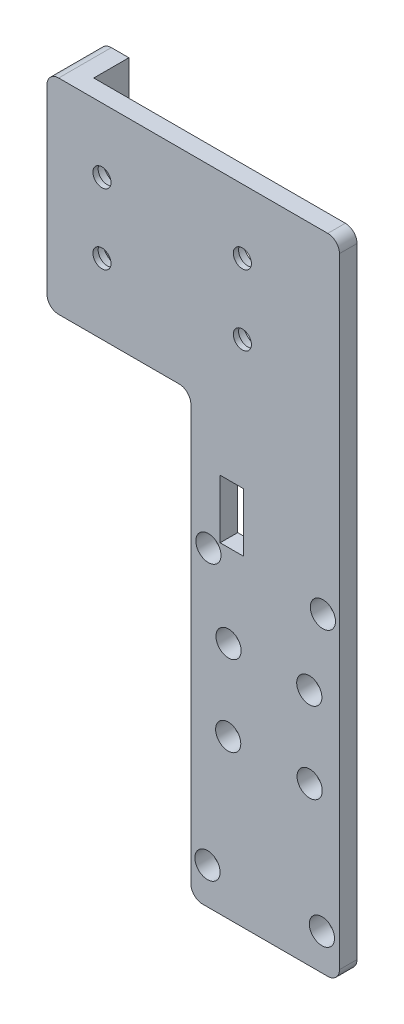
from build123d import *

# Parameters (mm, degrees)
BOSS_EXTRU_1_DEPTH                                 = 3
D_GAGEMENT_61_D                                    = 4.3053
CHAMBRAGE_POUR_VIS_T_TE_RONDE_BOMB_E_M_D           = 3.1
CHAMBRAGE_POUR_VIS_T_TE_RONDE_BOMB_E_M_CBORE_D     = 6
CHAMBRAGE_POUR_VIS_T_TE_RONDE_BOMB_E_M_CBORE_DEPTH = 2.1
ESQUISSE7_W                                        = 5
ESQUISSE7_H                                        = 20
BOSS_EXTRU_2_DEPTH                                 = 6
ENL_V_MAT_EXTRU_1_REACH                            = 117.582
ESQUISSE8_W                                        = 2
ESQUISSE8_H                                        = 6
ENL_V_MAT_EXTRU_2_REACH                            = 81.846
ESQUISSE9_W                                        = 6
ESQUISSE9_H                                        = 2
ENL_V_MAT_EXTRU_3_REACH                            = 122.972
ESQUISSE10_W                                       = 2
ESQUISSE10_H                                       = 6
CONG_1_R                                           = 2
D_GAGEMENT_65_D                                    = 4.3053
D_GAGEMENT_64_D                                    = 4.3053
ESQUISSE15_W                                       = 4
ESQUISSE15_H                                       = 10
ENL_V_MAT_EXTRU_4_DEPTH                            = 10


with BuildPart() as part:
    # Esquisse1 → Boss.-Extru.1 (new body)
    with BuildSketch(Plane.XY):
        Polygon((0, 0), (26.750817424, 0), (26.750817424, -109.991705561), (1.350817424, -109.991705561), (1.350817424, -35), (-23.249182576, -35), (-23.249182576, 0), align=None)
    extrude(amount=BOSS_EXTRU_1_DEPTH)

    # Dégagement #61 (through all)
    with Locations(Plane.XY.offset(3)):
        with Locations((21.588869509, -69.191705561), (7.788869509, -69.191705561), (7.729743851, -82.991705561), (21.650817424, -82.991705561)):
            Hole(D_GAGEMENT_61_D / 2)

    # Chambrage pour vis à tête ronde bombée M2.51 (through all)
    with Locations(Plane(origin=(0, 0, 0), x_dir=(-1, 0, 0), z_dir=(0, 0, -1))):
        with Locations((13.849182576, -23), (13.849182576, -11), (-10.150817424, -11), (-10.150817424, -23)):
            CounterBoreHole(CHAMBRAGE_POUR_VIS_T_TE_RONDE_BOMB_E_M_D / 2, CHAMBRAGE_POUR_VIS_T_TE_RONDE_BOMB_E_M_CBORE_D / 2, CHAMBRAGE_POUR_VIS_T_TE_RONDE_BOMB_E_M_CBORE_DEPTH)

    # Esquisse7 → Boss.-Extru.2 (add)
    with BuildSketch(Plane(origin=(0, 0, 0), x_dir=(-1, 0, 0), z_dir=(0, 0, -1))):
        Polygon((-11.750817424, -65), (-11.750817424, -35), (23.249182576, -35), (23.249182576, 0), (18.249182576, 0), (18.249182576, -30), (-16.750817424, -30), (-16.750817424, -65), align=None)
        with Locations((-14.250817424, -99.991705561)):
            Rectangle(ESQUISSE7_W, ESQUISSE7_H)
    extrude(amount=BOSS_EXTRU_2_DEPTH)

    # Esquisse8 → Enlèv. mat.-Extru.1 (cut, up to next)
    with BuildSketch(Plane.ZY.offset(-11.750817424), mode=Mode.PRIVATE) as enl_v_mat_extru_1_sk1:
        with Locations((-3, -51)):
            Rectangle(ESQUISSE8_W, ESQUISSE8_H)
    enl_v_mat_extru_1_tool1 = extrude(enl_v_mat_extru_1_sk1.sketch, amount=-ENL_V_MAT_EXTRU_1_REACH, mode=Mode.PRIVATE) & part.part
    add(enl_v_mat_extru_1_tool1.solids().sort_by_distance((11.750817, -51, -3))[0], mode=Mode.SUBTRACT)

    # Esquisse9 → Enlèv. mat.-Extru.2 (cut, up to next)
    with BuildSketch(Plane.XZ.offset(35), mode=Mode.PRIVATE) as enl_v_mat_extru_2_sk1:
        with Locations((-3.249182576, -3)):
            Rectangle(ESQUISSE9_W, ESQUISSE9_H)
    enl_v_mat_extru_2_tool1 = extrude(enl_v_mat_extru_2_sk1.sketch, amount=-ENL_V_MAT_EXTRU_2_REACH, mode=Mode.PRIVATE) & part.part
    add(enl_v_mat_extru_2_tool1.solids().sort_by_distance((-3.249183, -35, -3))[0], mode=Mode.SUBTRACT)

    # Esquisse10 → Enlèv. mat.-Extru.3 (cut, up to next)
    with BuildSketch(Plane.ZY.offset(23.249182576), mode=Mode.PRIVATE) as enl_v_mat_extru_3_sk1:
        with Locations((-3, -17)):
            Rectangle(ESQUISSE10_W, ESQUISSE10_H)
    enl_v_mat_extru_3_tool1 = extrude(enl_v_mat_extru_3_sk1.sketch, amount=-ENL_V_MAT_EXTRU_3_REACH, mode=Mode.PRIVATE) & part.part
    add(enl_v_mat_extru_3_tool1.solids().sort_by_distance((-23.249183, -17, -3))[0], mode=Mode.SUBTRACT)

    # Congé1
    cong_1_edges = [part.edges().sort_by_distance(p)[0] for p in [
        (26.750817424, 0, 1.5),
        (26.750817424, -109.991705561, 1.5),
        (1.350817424, -109.991705561, 1.5),
        (1.350817424, -35, 1.5),
        (-23.249182576, -35, -1.5),
        (-23.249182576, 0, -1.5),
        (-18.249182576, -30, -3),
        (16.750817424, -30, -3),
        (11.750817424, -35, -3),
    ]]
    fillet(cong_1_edges, radius=CONG_1_R)

    # Dégagement #65 (through all)
    with Locations(Plane(origin=(0, 0, 0), x_dir=(-1, 0, 0), z_dir=(0, 0, -1))):
        with Locations((-23.750817424, -103.791705561), (-4.190817424, -103.791705561)):
            Hole(D_GAGEMENT_65_D / 2)

    # Dégagement #64 (through all)
    with Locations(Plane(origin=(0, 0, 0), x_dir=(-1, 0, 0), z_dir=(0, 0, -1))):
        with Locations((-23.910817424, -56.791705561), (-4.350817424, -56.791705561)):
            Hole(D_GAGEMENT_64_D / 2)

    # Esquisse15 → Enlèv. mat.-Extru.4 (cut)
    with BuildSketch(Plane.XY.offset(3)):
        with Locations((8.350817424, -50)):
            Rectangle(ESQUISSE15_W, ESQUISSE15_H)
    extrude(amount=-ENL_V_MAT_EXTRU_4_DEPTH, mode=Mode.SUBTRACT)


solid = part.part
